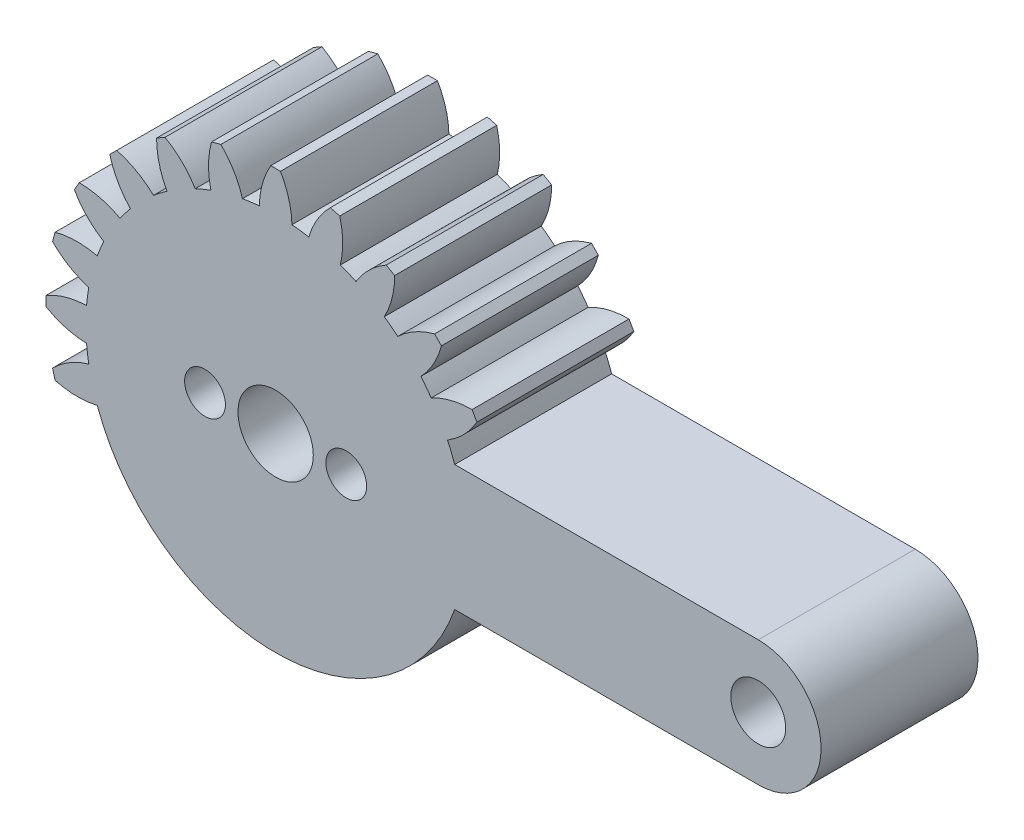
from build123d import *

# Parameters (mm, degrees)
SKETCH1_R           = 1.75
BOSS_EXTRUDE1_DEPTH = 10
SKETCH2_R           = 1.3
SKETCH2_R_2         = 2.4
CUT_EXTRUDE1_DEPTH  = 40.007683858


with BuildPart() as part:
    # Sketch1 → Boss-Extrude1 (new body)
    with BuildSketch(Plane.XY):
        with BuildLine():
            Line((0.31, 14.63), (-0.31, 14.63))
            ThreePointArc((-0.31, 14.63), (-0.838273314, 13.383704325), (-1.04, 12.04518576))
            ThreePointArc((-1.04, 12.04518576), (-1.578061664, 11.986568374), (-2.112960617, 11.903927815))
            ThreePointArc((-2.112960617, 11.903927815), (-2.65424773, 13.144626757), (-3.487085624, 14.211728743))
            Line((-3.487085624, 14.211728743), (-4.085959636, 14.051260935))
            ThreePointArc((-4.085959636, 14.051260935), (-4.273667417, 12.71070456), (-4.122086336, 11.365584201))
            ThreePointArc((-4.122086336, 11.365584201), (-4.626642697, 11.169703548), (-5.12192646, 10.951436862))
            ThreePointArc((-5.12192646, 10.951436862), (-5.965886177, 12.009764599), (-7.046532125, 12.824951657))
            Line((-7.046532125, 12.824951657), (-7.583467875, 12.514951657))
            ThreePointArc((-7.583467875, 12.514951657), (-7.417818147, 11.171491285), (-6.9232593, 9.911436862))
            ThreePointArc((-6.9232593, 9.911436862), (-7.359925677, 9.591641884), (-7.781841479, 9.252623584))
            ThreePointArc((-7.781841479, 9.252623584), (-8.870959341, 10.05645683), (-10.125769107, 10.564175311))
            Line((-10.125769107, 10.564175311), (-10.564175311, 10.125769107))
            ThreePointArc((-10.564175311, 10.125769107), (-10.05645683, 8.870959341), (-9.252623584, 7.781841479))
            ThreePointArc((-9.252623584, 7.781841479), (-9.591641884, 7.359925677), (-9.911436862, 6.9232593))
            ThreePointArc((-9.911436862, 6.9232593), (-11.171491285, 7.417818147), (-12.514951657, 7.583467875))
            Line((-12.514951657, 7.583467875), (-12.824951657, 7.046532125))
            ThreePointArc((-12.824951657, 7.046532125), (-12.009764599, 5.965886177), (-10.951436862, 5.12192646))
            ThreePointArc((-10.951436862, 5.12192646), (-11.169703548, 4.626642697), (-11.365584201, 4.122086336))
            ThreePointArc((-11.365584201, 4.122086336), (-12.71070456, 4.273667417), (-14.051260935, 4.085959636))
            Line((-14.051260935, 4.085959636), (-14.211728743, 3.487085624))
            ThreePointArc((-14.211728743, 3.487085624), (-13.144626757, 2.65424773), (-11.903927815, 2.112960617))
            ThreePointArc((-11.903927815, 2.112960617), (-11.986568374, 1.578061664), (-12.04518576, 1.04))
            ThreePointArc((-12.04518576, 1.04), (-13.383704325, 0.838273314), (-14.63, 0.31))
            Line((-14.63, 0.31), (-14.63, -0.31))
            ThreePointArc((-14.63, -0.31), (-13.383704325, -0.838273314), (-12.04518576, -1.04))
            ThreePointArc((-12.04518576, -1.04), (-11.986568374, -1.578061664), (-11.903927815, -2.112960617))
            ThreePointArc((-11.903927815, -2.112960617), (-13.144626757, -2.65424773), (-14.211728743, -3.487085624))
            Line((-14.211728743, -3.487085624), (-14.051260935, -4.085959636))
            ThreePointArc((-14.051260935, -4.085959636), (-12.71070456, -4.273667417), (-11.365584201, -4.122086336))
            ThreePointArc((-11.365584201, -4.122086336), (0.064808849, -12.089826294), (11.409123542, -4))
            Line((11.409123542, -4), (30.75, -4))
            ThreePointArc((30.75, -4), (34.75, 0), (30.75, 4))
            Line((30.75, 4), (11.409123542, 4))
            ThreePointArc((11.409123542, 4), (11.194344337, 4.566700654), (10.951436862, 5.12192646))
            ThreePointArc((10.951436862, 5.12192646), (12.009764599, 5.965886177), (12.824951657, 7.046532125))
            Line((12.824951657, 7.046532125), (12.514951657, 7.583467875))
            ThreePointArc((12.514951657, 7.583467875), (11.171491285, 7.417818147), (9.911436862, 6.9232593))
            ThreePointArc((9.911436862, 6.9232593), (9.591641884, 7.359925677), (9.252623584, 7.781841479))
            ThreePointArc((9.252623584, 7.781841479), (10.05645683, 8.870959341), (10.564175311, 10.125769107))
            Line((10.564175311, 10.125769107), (10.125769107, 10.564175311))
            ThreePointArc((10.125769107, 10.564175311), (8.870959341, 10.05645683), (7.781841479, 9.252623584))
            ThreePointArc((7.781841479, 9.252623584), (7.359925677, 9.591641884), (6.9232593, 9.911436862))
            ThreePointArc((6.9232593, 9.911436862), (7.417818147, 11.171491285), (7.583467875, 12.514951657))
            Line((7.583467875, 12.514951657), (7.046532125, 12.824951657))
            ThreePointArc((7.046532125, 12.824951657), (5.965886177, 12.009764599), (5.12192646, 10.951436862))
            ThreePointArc((5.12192646, 10.951436862), (4.626642697, 11.169703548), (4.122086336, 11.365584201))
            ThreePointArc((4.122086336, 11.365584201), (4.273667417, 12.71070456), (4.085959636, 14.051260935))
            Line((4.085959636, 14.051260935), (3.487085624, 14.211728743))
            ThreePointArc((3.487085624, 14.211728743), (2.65424773, 13.144626757), (2.112960617, 11.903927815))
            ThreePointArc((2.112960617, 11.903927815), (1.578061664, 11.986568374), (1.04, 12.04518576))
            ThreePointArc((1.04, 12.04518576), (0.838273314, 13.383704325), (0.31, 14.63))
        make_face()
        Circle(SKETCH1_R, mode=Mode.SUBTRACT)
        with Locations((30.75, 0)):
            Circle(SKETCH1_R, mode=Mode.SUBTRACT)
    extrude(amount=BOSS_EXTRUDE1_DEPTH)

    # Sketch2 → Cut-Extrude1 (cut, through all)
    with BuildSketch(Plane.XY.offset(10)):
        with Locations((-4.5, 0)):
            Circle(SKETCH2_R)
        Circle(SKETCH2_R_2)
        with Locations((4.5, 0)):
            Circle(SKETCH2_R)
    extrude(amount=-CUT_EXTRUDE1_DEPTH, mode=Mode.SUBTRACT)


solid = part.part
